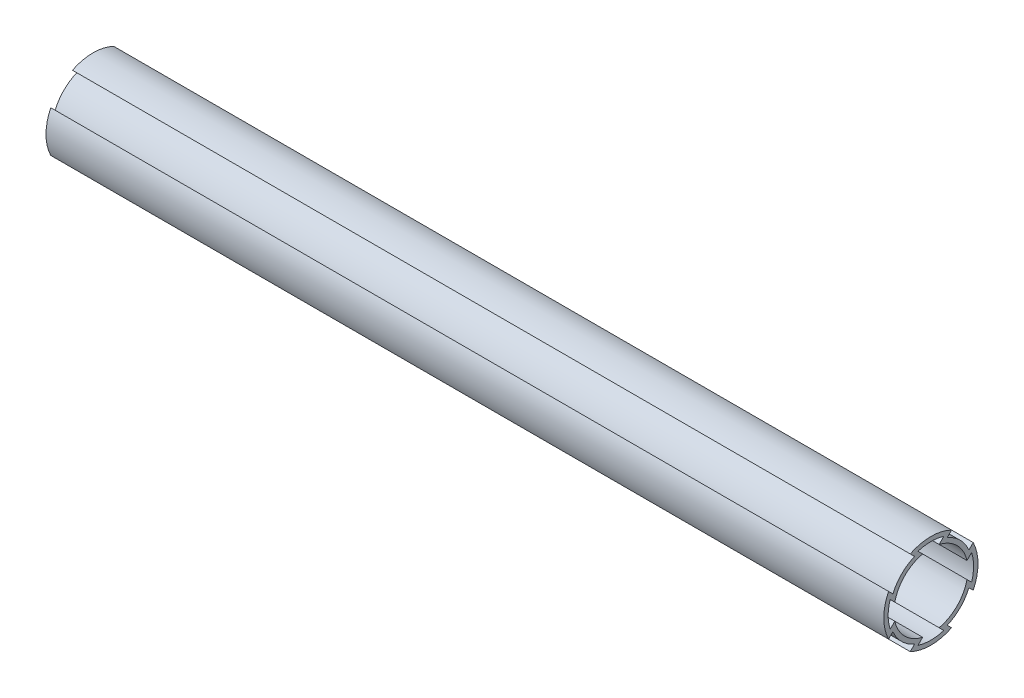
from build123d import *

# Parameters (mm, degrees)
BOSS_EXTRUDE1_DEPTH = 249


with BuildPart() as part:
    # Sketch1 → Boss-Extrude1 (new body)
    with BuildSketch(Plane(origin=(0, 0, 0), x_dir=(0, 0, -1), z_dir=(1, 0, 0))):
        with BuildLine():
            Line((-11.297790668, 4.86311896), (-12.579426967, 6.144755258))
            ThreePointArc((-12.579426967, 6.144755258), (-14, 0), (-12.579426967, -6.144755258))
            Line((-12.579426967, -6.144755258), (-11.297790668, -4.86311896))
            ThreePointArc((-11.297790668, -4.86311896), (-8.697413409, -8.697413409), (-4.86311896, -11.297790668))
            Line((-4.86311896, -11.297790668), (-6.144755258, -12.579426967))
            ThreePointArc((-6.144755258, -12.579426967), (0, -14), (6.144755258, -12.579426967))
            Line((6.144755258, -12.579426967), (4.86311896, -11.297790668))
            ThreePointArc((4.86311896, -11.297790668), (8.697413409, -8.697413409), (11.297790668, -4.86311896))
            Line((11.297790668, -4.86311896), (12.579426967, -6.144755258))
            ThreePointArc((12.579426967, -6.144755258), (13.64023419, -3.153412633), (14, 0))
            ThreePointArc((14, 0), (13.64023419, 3.153412633), (12.579426967, 6.144755258))
            Line((12.579426967, 6.144755258), (11.297790668, 4.86311896))
            ThreePointArc((11.297790668, 4.86311896), (8.697413409, 8.697413409), (4.86311896, 11.297790668))
            Line((4.86311896, 11.297790668), (6.144755258, 12.579426967))
            ThreePointArc((6.144755258, 12.579426967), (0, 14), (-6.144755258, 12.579426967))
            Line((-6.144755258, 12.579426967), (-4.86311896, 11.297790668))
            ThreePointArc((-4.86311896, 11.297790668), (-8.697413409, 8.697413409), (-11.297790668, 4.86311896))
        make_face()
        with BuildLine():
            Line((-10.723588409, 2.450439069), (-12.107380777, 3.834231437))
            ThreePointArc((-12.107380777, 3.834231437), (-12.7, 0), (-12.107380777, -3.834231437))
            Line((-12.107380777, -3.834231437), (-10.723588409, -2.450439069))
            ThreePointArc((-10.723588409, -2.450439069), (-7.778174593, -7.778174593), (-2.450439069, -10.723588409))
            Line((-2.450439069, -10.723588409), (-3.834231437, -12.107380777))
            ThreePointArc((-3.834231437, -12.107380777), (0, -12.7), (3.834231437, -12.107380777))
            Line((3.834231437, -12.107380777), (2.450439069, -10.723588409))
            ThreePointArc((2.450439069, -10.723588409), (7.778174593, -7.778174593), (10.723588409, -2.450439069))
            Line((10.723588409, -2.450439069), (12.107380777, -3.834231437))
            ThreePointArc((12.107380777, -3.834231437), (12.550970797, -1.939879394), (12.7, 0))
            ThreePointArc((12.7, 0), (12.550970797, 1.939879394), (12.107380777, 3.834231437))
            Line((12.107380777, 3.834231437), (10.723588409, 2.450439069))
            ThreePointArc((10.723588409, 2.450439069), (7.778174593, 7.778174593), (2.450439069, 10.723588409))
            Line((2.450439069, 10.723588409), (3.834231437, 12.107380777))
            ThreePointArc((3.834231437, 12.107380777), (0, 12.7), (-3.834231437, 12.107380777))
            Line((-3.834231437, 12.107380777), (-2.450439069, 10.723588409))
            ThreePointArc((-2.450439069, 10.723588409), (-7.778174593, 7.778174593), (-10.723588409, 2.450439069))
        make_face(mode=Mode.SUBTRACT)
    extrude(amount=BOSS_EXTRUDE1_DEPTH)


solid = part.part
